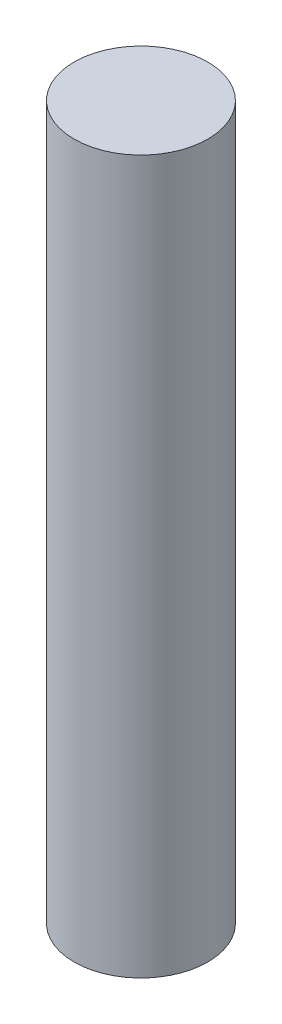
from build123d import *

# Parameters (mm, degrees)
SKETCH1_R           = 7.5
BOSS_EXTRUDE1_DEPTH = 80


with BuildPart() as part:
    # Sketch1 → Boss-Extrude1 (new body)
    with BuildSketch(Plane(origin=(0, 0, 0), x_dir=(1, 0, 0), z_dir=(0, 1, 0))):
        with Locations(Location((0, 0, 0), (0, 0, 270))):
            Circle(SKETCH1_R)
    extrude(amount=BOSS_EXTRUDE1_DEPTH)


solid = part.part
